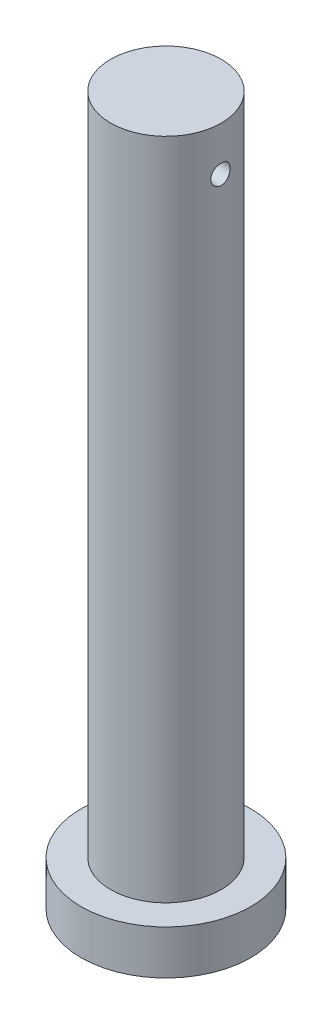
from build123d import *

# Parameters (mm, degrees)
SKETCH1_R           = 23
BOSS_EXTRUDE1_DEPTH = 12
SKETCH2_R           = 15
BOSS_EXTRUDE2_DEPTH = 180
SCALE1_SCALE        = 0.33


with BuildPart() as part:
    # Sketch1 → Boss-Extrude1 (new body)
    with BuildSketch(Plane(origin=(0, 0, 0), x_dir=(1, 0, 0), z_dir=(0, 1, 0))):
        with Locations(Location((0, 0, 0), (0, 0, 270))):
            Circle(SKETCH1_R)
    extrude(amount=BOSS_EXTRUDE1_DEPTH)

    # Sketch2 → Boss-Extrude2 (add)
    with BuildSketch(Plane(origin=(0, 12, 0), x_dir=(1, 0, 0), z_dir=(0, 1, 0))):
        with Locations(Location((0, 0, 0), (0, 0, 90))):
            Circle(SKETCH2_R)
    extrude(amount=BOSS_EXTRUDE2_DEPTH)

    # Sketch4 → Cut-Revolve4 (revolve, cut)
    with BuildSketch(Plane(origin=(0, 180, 0), x_dir=(1, 0, 0), z_dir=(0, 1, 0)), mode=Mode.PRIVATE) as cut_revolve4_sk:
        Polygon((30, 0), (-30, 0), (-30, 3), (30, 2.5), align=None)
    revolve(cut_revolve4_sk.sketch.rotate(Axis((30, 180, 0), (-1, 0, 0)), 43.222244731), axis=Axis((30, 180, 0), (-1, 0, 0)), mode=Mode.SUBTRACT)


with BuildPart() as part_1:
    # Scale1: scaled about (0.002156462, 88.550518563, 3e-09)
    add(part.part.scale(SCALE1_SCALE).moved(Location((0.00144483, 59.328847437, 2e-09))))


solid = part_1.part
